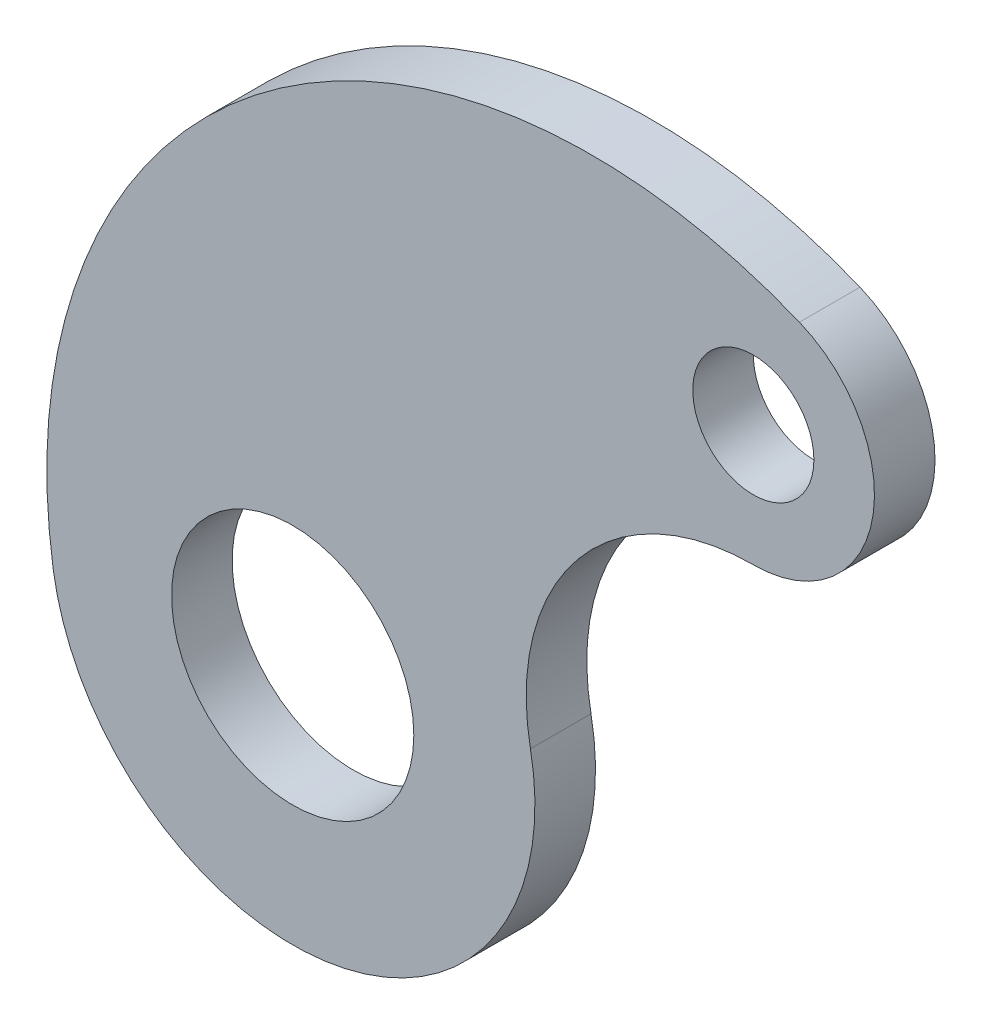
from build123d import *

# Parameters (mm, degrees)
SKETCH1_R           = 40
SKETCH1_R_2         = 20
BOSS_EXTRUDE1_DEPTH = 20


with BuildPart() as part:
    # Sketch1 → Boss-Extrude1 (new body)
    with BuildSketch(Plane.XY):
        with BuildLine():
            ThreePointArc((-79.055292414, -12.258088811), (13.817575886, -78.797681417), (78.509310225, 15.371669004))
            ThreePointArc((78.509310225, 15.371669004), (94.207468874, 77.449051416), (152.111788561, 104.782608696))
            ThreePointArc((152.111788561, 104.782608696), (191.351709755, 137.021900953), (167.338266574, 181.771179462))
            ThreePointArc((167.338266574, 181.771179462), (-12.542827211, 156.738726473), (-79.055292414, -12.258088811))
        make_face()
        Circle(SKETCH1_R, mode=Mode.SUBTRACT)
        with Locations((152.111788561, 144.782608696)):
            Circle(SKETCH1_R_2, mode=Mode.SUBTRACT)
    extrude(amount=BOSS_EXTRUDE1_DEPTH)


solid = part.part
